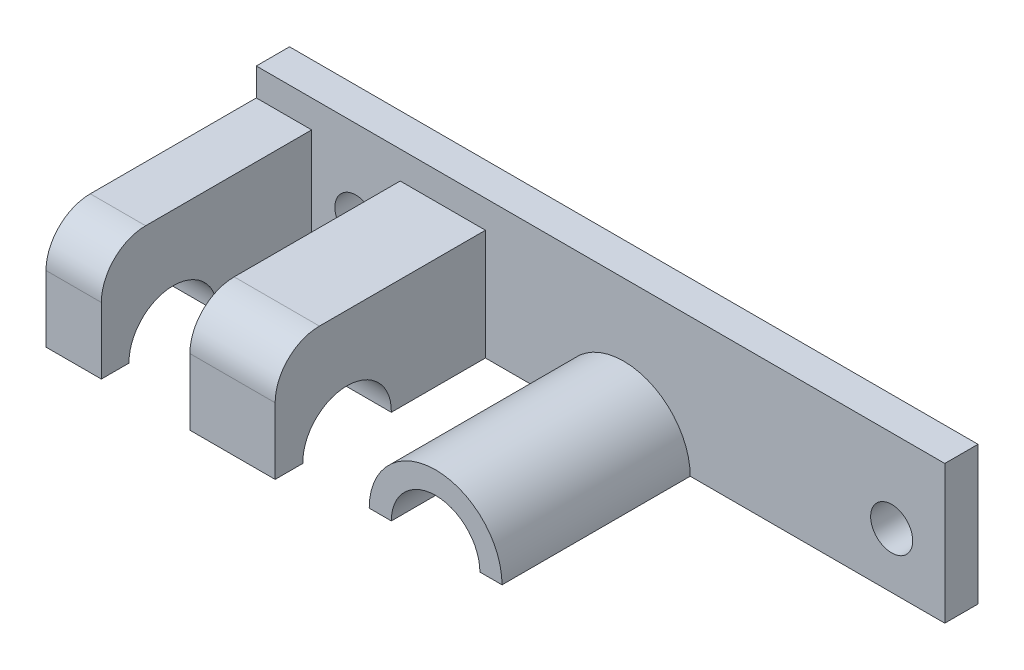
from build123d import *

# Parameters (mm, degrees)
SKETCH1_W           = 58
SKETCH1_H           = 25
SKETCH1_R           = 1.9
BOSS_EXTRUDE1_DEPTH = 3
SKETCH2_R           = 6
BOSS_EXTRUDE2_DEPTH = 20
SKETCH3_R           = 4
CUT_EXTRUDE1_DEPTH  = 38.379807383
SKETCH4_W           = 7.7
SKETCH4_H           = 19.996282454
BOSS_EXTRUDE3_DEPTH = 19
CUT_EXTRUDE2_REACH  = 57.325
SKETCH5_R           = 4
FILLET1_R           = 4
SKETCH7_W           = 4.2
SKETCH7_H           = 25
BOSS_EXTRUDE4_DEPTH = 3
SKETCH8_W           = 5
SKETCH8_H           = 19.996282454
BOSS_EXTRUDE5_DEPTH = 19
CUT_EXTRUDE3_REACH  = 64.547
SKETCH9_R           = 4
FILLET2_R           = 4
SKETCH10_W          = 62.2
SKETCH10_H          = 12.5
CUT_EXTRUDE4_DEPTH  = 42.74314315


with BuildPart() as part:
    # Sketch1 → Boss-Extrude1 (new body)
    with BuildSketch(Plane.XY):
        Rectangle(SKETCH1_W, SKETCH1_H)
        with Locations((24.2, 5)):
            Circle(SKETCH1_R, mode=Mode.SUBTRACT)
        with Locations((24.2, -5)):
            Circle(SKETCH1_R, mode=Mode.SUBTRACT)
        with Locations((-24.2, 5)):
            Circle(SKETCH1_R, mode=Mode.SUBTRACT)
        with Locations((-24.2, -5)):
            Circle(SKETCH1_R, mode=Mode.SUBTRACT)
    extrude(amount=BOSS_EXTRUDE1_DEPTH)

    # Sketch2 → Boss-Extrude2 (add)
    with BuildSketch(Plane.XY):
        Circle(SKETCH2_R)
    extrude(amount=BOSS_EXTRUDE2_DEPTH)

    # Sketch3 → Cut-Extrude1 (cut, through all)
    with BuildSketch(Plane.XY.offset(20)):
        Circle(SKETCH3_R)
    extrude(amount=-CUT_EXTRUDE1_DEPTH, mode=Mode.SUBTRACT)

    # Sketch4 → Boss-Extrude3 (add)
    with BuildSketch(Plane.XY.offset(3)):
        with Locations((-16.35, 0)):
            Rectangle(SKETCH4_W, SKETCH4_H)
    extrude(amount=BOSS_EXTRUDE3_DEPTH)

    # Sketch5 → Cut-Extrude2 (cut, up to next)
    with BuildSketch(Plane.ZY.offset(20.2), mode=Mode.PRIVATE) as cut_extrude2_sk1:
        with Locations((15.5, 0.080826905)):
            Circle(SKETCH5_R)
    cut_extrude2_tool1 = extrude(cut_extrude2_sk1.sketch, amount=-CUT_EXTRUDE2_REACH, mode=Mode.PRIVATE) & part.part
    add(cut_extrude2_tool1.solids().sort_by_distance((-20.2, 0.080827, 15.5))[0], mode=Mode.SUBTRACT)

    # Fillet1
    fillet1_edges = [part.edges().sort_by_distance(p)[0] for p in [
        (-16.35, 9.998141227, 22),
        (-16.35, -9.998141227, 22),
    ]]
    fillet(fillet1_edges, radius=FILLET1_R)

    # Sketch7 → Boss-Extrude4 (add)
    with BuildSketch(Plane.XY.offset(3)):
        with Locations((-31.1, 0)):
            Rectangle(SKETCH7_W, SKETCH7_H)
    extrude(amount=-BOSS_EXTRUDE4_DEPTH)

    # Sketch8 → Boss-Extrude5 (add)
    with BuildSketch(Plane.XY.offset(3)):
        with Locations((-30.7, 0)):
            Rectangle(SKETCH8_W, SKETCH8_H)
    extrude(amount=BOSS_EXTRUDE5_DEPTH)

    # Sketch9 → Cut-Extrude3 (cut, up to next)
    with BuildSketch(Plane(origin=(-28.2, 0, 0), x_dir=(0, 0, -1), z_dir=(1, 0, 0)), mode=Mode.PRIVATE) as cut_extrude3_sk1:
        with Locations(Location((-15.5, 0.063578072, 0), (0, 0, 90))):
            Circle(SKETCH9_R)
    cut_extrude3_tool1 = extrude(cut_extrude3_sk1.sketch, amount=-CUT_EXTRUDE3_REACH, mode=Mode.PRIVATE) & part.part
    add(cut_extrude3_tool1.solids().sort_by_distance((-28.2, 0.063578, 15.5))[0], mode=Mode.SUBTRACT)

    # Fillet2
    fillet2_edges = [part.edges().sort_by_distance(p)[0] for p in [
        (-30.7, 9.998141227, 22),
        (-30.7, -9.998141227, 22),
    ]]
    fillet(fillet2_edges, radius=FILLET2_R)

    # Sketch10 → Cut-Extrude4 (cut, through all)
    with BuildSketch(Plane(origin=(0, 0, 0), x_dir=(-1, 0, 0), z_dir=(0, 0, -1))):
        with Locations((2.1, -6.25)):
            Rectangle(SKETCH10_W, SKETCH10_H)
    extrude(amount=-CUT_EXTRUDE4_DEPTH, mode=Mode.SUBTRACT)


solid = part.part
